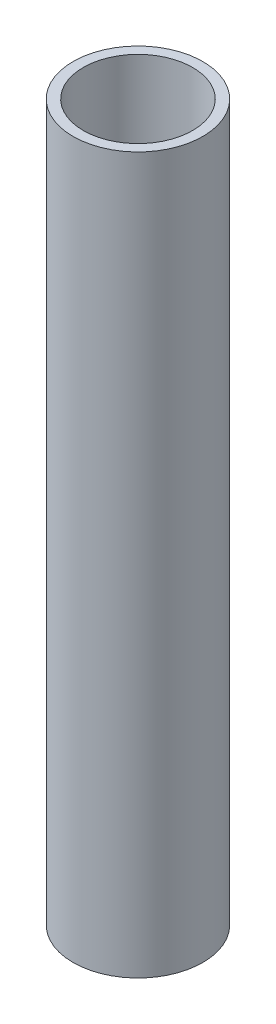
from build123d import *

# Parameters (mm, degrees)
SKETCH1_R           = 6.35
SKETCH1_R_2         = 5.35
BOSS_EXTRUDE1_DEPTH = 70


with BuildPart() as part:
    # Sketch1 → Boss-Extrude1 (new body)
    with BuildSketch(Plane(origin=(0, 0, 0), x_dir=(1, 0, 0), z_dir=(0, 1, 0))):
        with Locations(Location((0, 0, 0), (0, 0, 270))):
            Circle(SKETCH1_R)
        with Locations(Location((0, 0, 0), (0, 0, 270))):
            Circle(SKETCH1_R_2, mode=Mode.SUBTRACT)
    extrude(amount=BOSS_EXTRUDE1_DEPTH)


solid = part.part
